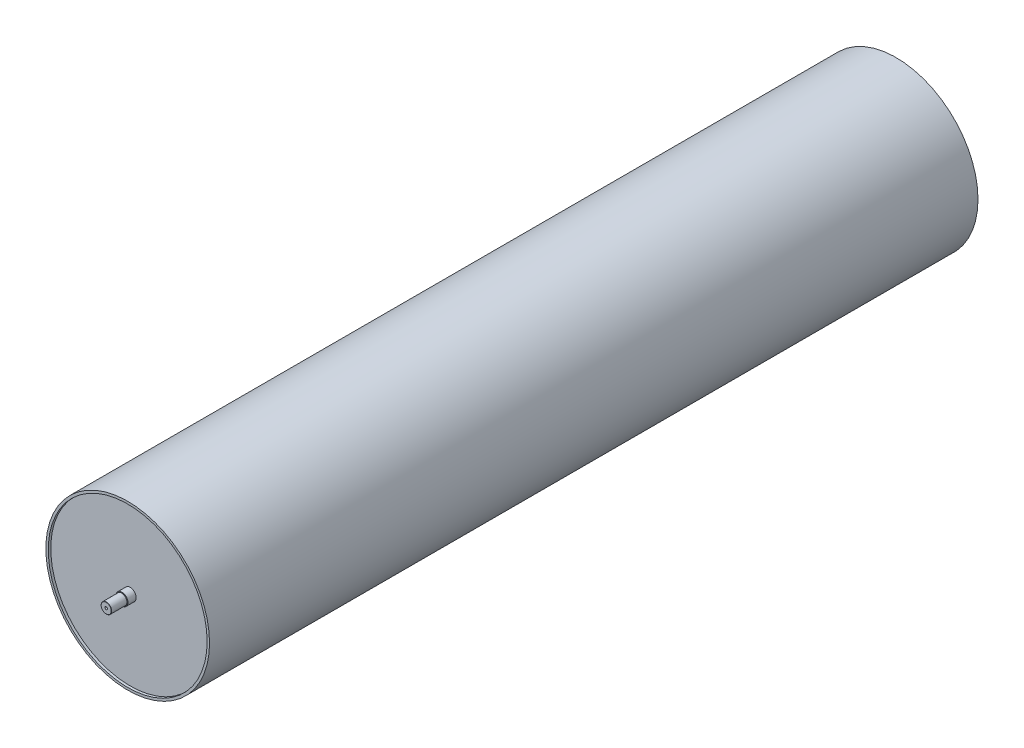
from build123d import *

# Parameters (mm, degrees)
SKETCH1_R             = 163.5
SKETCH1_R_2           = 158.7
BOSS_EXTRUDE1_DEPTH   = 767.5
BOSS_EXTRUDE2_START   = -10
SKETCH2_R             = 158.7
BOSS_EXTRUDE2_DEPTH   = 5
CHAMFER1_SIZE         = 0.5
M6_TAPPED_HOLE1_D     = 5
M6_TAPPED_HOLE1_DEPTH = 15
M6_TAPPED_HOLE1_TIP   = 1.502151548
SKETCH8_R             = 7
BOSS_EXTRUDE3_DEPTH   = 30
CHAMFER2_SIZE         = 0.5


with BuildPart() as part:
    # Sketch1 → Boss-Extrude1 (new, symmetric)
    with BuildSketch(Plane.XY):
        Circle(SKETCH1_R)
        Circle(SKETCH1_R_2, mode=Mode.SUBTRACT)
    extrude(amount=BOSS_EXTRUDE1_DEPTH, both=True)

    # Sketch2 → Boss-Extrude2 (add)
    with BuildSketch(Plane.XY.offset(767.5).offset(BOSS_EXTRUDE2_START)):
        Circle(SKETCH2_R)
    boss_extrude2 = extrude(amount=BOSS_EXTRUDE2_DEPTH)

    # Sketch5 → Revolve1 (revolve)
    with BuildSketch(Plane(origin=(0, 0, 0), x_dir=(0, 0, -1), z_dir=(1, 0, 0)), mode=Mode.PRIVATE) as revolve1_sk:
        Polygon((-779.5, 12), (779.5, 12), (779.5, 10.5), (810.5, 10.5), (810.5, 0), (-810.5, 0), (-810.5, 10.5), (-779.5, 10.5), align=None)
    revolve(revolve1_sk.sketch.rotate(Axis((0, 0, -810.5), (0, 0, -1)), 180), axis=Axis((0, 0, -810.5), (0, 0, -1)))

    # Chamfer1
    chamfer1_edges = [part.edges().sort_by_distance(p)[0] for p in [
        (0, 12, -779.5),
        (0, 12, 779.5),
        (0, 10.5, -810.5),
        (0, 10.5, 810.5),
    ]]
    chamfer(chamfer1_edges, length=CHAMFER1_SIZE)

    # M6 Tapped Hole1
    with Locations(Plane.XY.offset(810.5)):
        with Locations((0, 0)):
            Hole(M6_TAPPED_HOLE1_D / 2, depth=M6_TAPPED_HOLE1_DEPTH)
            with Locations((0, 0, -(M6_TAPPED_HOLE1_DEPTH + M6_TAPPED_HOLE1_TIP / 2))):  # 118° drill point
                Cone(0, M6_TAPPED_HOLE1_D / 2, M6_TAPPED_HOLE1_TIP, mode=Mode.SUBTRACT)

    # Mirror3: Boss-Extrude2 across plane
    add(boss_extrude2.mirror(Plane.XY))

    # Sketch8 → Boss-Extrude3 (add)
    with BuildSketch(Plane(origin=(0, 0, -810.5), x_dir=(-1, 0, 0), z_dir=(0, 0, -1))):
        with Locations(Location((0, 0, 0), (0, 0, 90))):
            Circle(SKETCH8_R)
    extrude(amount=BOSS_EXTRUDE3_DEPTH)

    # Chamfer2
    chamfer2_edges = [part.edges().sort_by_distance(p)[0] for p in [
        (0, -7, -840.5),
    ]]
    chamfer(chamfer2_edges, length=CHAMFER2_SIZE)


solid = part.part
